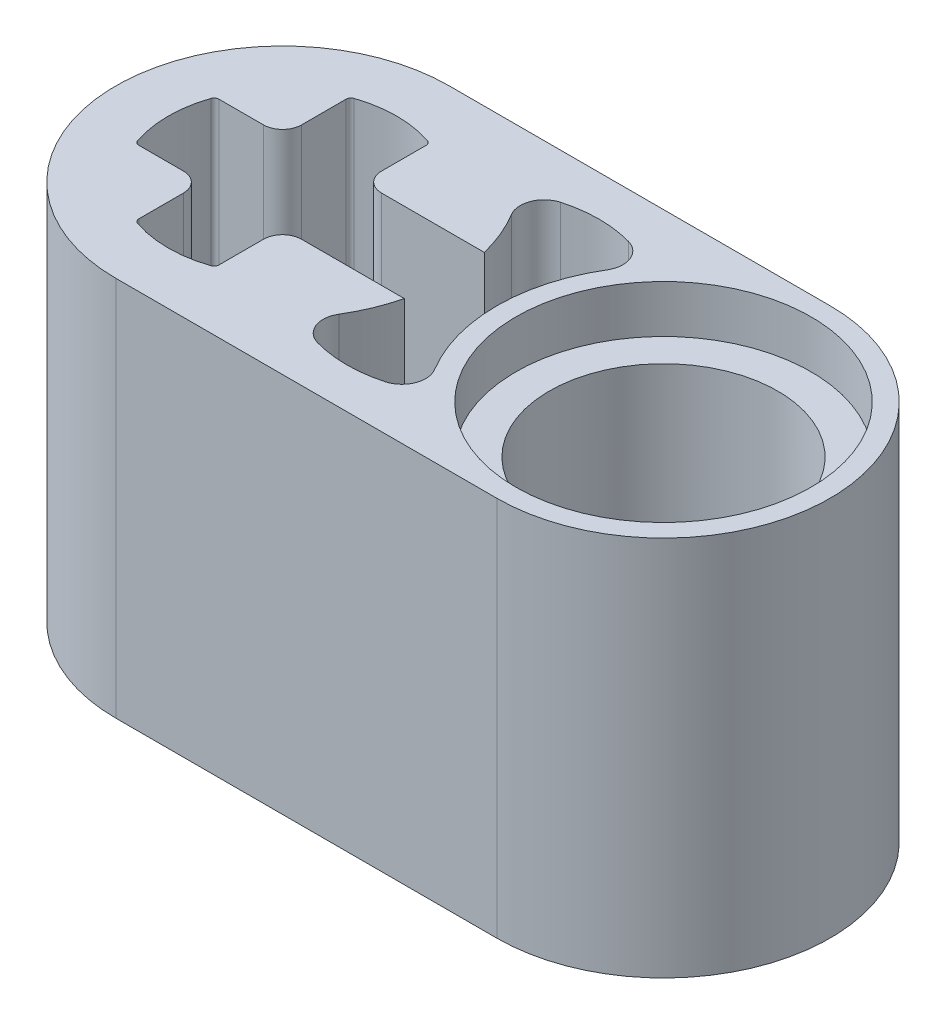
from build123d import *

# Parameters (mm, degrees)
BOSS_EXTRUDE1_DEPTH = 4
SKETCH2_R           = 2.4
CUT_EXTRUDE1_DEPTH  = 12.510864433
SKETCH3_R           = 3.1
CUT_EXTRUDE2_DEPTH  = 1


with BuildPart() as part:
    # Sketch1 → Boss-Extrude1 (new, symmetric)
    with BuildSketch(Plane(origin=(0, 0, 0), x_dir=(1, 0, 0), z_dir=(0, 1, 0))):
        with BuildLine():
            Line((-4, 3.5), (4, 3.5))
            ThreePointArc((4, 3.5), (7.5, 0), (4, -3.5))
            Line((4, -3.5), (-4, -3.5))
            ThreePointArc((-4, -3.5), (-7.5, 0), (-4, 3.5))
        make_face()
    extrude(amount=BOSS_EXTRUDE1_DEPTH, both=True)

    # Sketch2 → Cut-Extrude1 (cut, through all)
    with BuildSketch(Plane(origin=(0, 4, 0), x_dir=(1, 0, 0), z_dir=(0, 1, 0))):
        with Locations(Location((4, 0, 0), (0, 0, 270))):
            Circle(SKETCH2_R)
        with BuildLine():
            Line((-4.84, -2.177705214), (-4.84, -1.24))
            ThreePointArc((-4.84, -1.24), (-4.957157288, -0.957157288), (-5.24, -0.84))
            Line((-5.24, -0.84), (-6.177705214, -0.84))
            ThreePointArc((-6.177705214, -0.84), (-6.235940121, -0.821293884), (-6.27238805, -0.772173913))
            ThreePointArc((-6.27238805, -0.772173913), (-6.4, 0), (-6.27238805, 0.772173913))
            ThreePointArc((-6.27238805, 0.772173913), (-6.235940121, 0.821293884), (-6.177705214, 0.84))
            Line((-6.177705214, 0.84), (-5.24, 0.84))
            ThreePointArc((-5.24, 0.84), (-4.957157288, 0.957157288), (-4.84, 1.24))
            Line((-4.84, 1.24), (-4.84, 2.177705214))
            ThreePointArc((-4.84, 2.177705214), (-4.821293884, 2.235940121), (-4.772173913, 2.27238805))
            ThreePointArc((-4.772173913, 2.27238805), (-4, 2.4), (-3.227826087, 2.27238805))
            ThreePointArc((-3.227826087, 2.27238805), (-3.178706116, 2.235940121), (-3.16, 2.177705214))
            Line((-3.16, 2.177705214), (-3.16, 1.24))
            ThreePointArc((-3.16, 1.24), (-3.042842712, 0.957157288), (-2.76, 0.84))
            Line((-2.76, 0.84), (-1.822294786, 0.84))
            Line((-1.822294786, 0.84), (-0.602294892, 0.84))
            ThreePointArc((-0.602294892, 0.84), (-0.767197546, 1.341263694), (-1.005585937, 1.812038747))
            ThreePointArc((-1.005585937, 1.812038747), (-1.042652048, 2.255086643), (-0.7121875, 2.552506408))
            ThreePointArc((-0.7121875, 2.552506408), (0, 2.65), (0.7121875, 2.552506408))
            ThreePointArc((0.7121875, 2.552506408), (1.042652048, 2.255086643), (1.005585937, 1.812038747))
            ThreePointArc((1.005585937, 1.812038747), (0.5, 0), (1.005585938, -1.812038747))
            ThreePointArc((1.005585938, -1.812038747), (1.042652048, -2.255086643), (0.7121875, -2.552506408))
            ThreePointArc((0.7121875, -2.552506408), (0, -2.65), (-0.7121875, -2.552506408))
            ThreePointArc((-0.7121875, -2.552506408), (-1.042652048, -2.255086643), (-1.005585937, -1.812038747))
            ThreePointArc((-1.005585937, -1.812038747), (-0.767197546, -1.341263694), (-0.602294892, -0.84))
            Line((-0.602294892, -0.84), (-1.822294786, -0.84))
            Line((-1.822294786, -0.84), (-2.76, -0.84))
            ThreePointArc((-2.76, -0.84), (-3.042842712, -0.957157288), (-3.16, -1.24))
            Line((-3.16, -1.24), (-3.16, -2.177705214))
            ThreePointArc((-3.16, -2.177705214), (-3.178706116, -2.235940121), (-3.227826087, -2.27238805))
            ThreePointArc((-3.227826087, -2.27238805), (-4, -2.4), (-4.772173913, -2.27238805))
            ThreePointArc((-4.772173913, -2.27238805), (-4.821293884, -2.235940121), (-4.84, -2.177705214))
        make_face()
    extrude(amount=-CUT_EXTRUDE1_DEPTH, mode=Mode.SUBTRACT)

    # Sketch3 → Cut-Extrude2 (cut)
    with BuildSketch(Plane(origin=(0, 4, 0), x_dir=(1, 0, 0), z_dir=(0, 1, 0))):
        with Locations(Location((4, 0, 0), (0, 0, 270))):
            Circle(SKETCH3_R)
    cut_extrude2 = extrude(amount=-CUT_EXTRUDE2_DEPTH, mode=Mode.SUBTRACT)

    # Mirror1: Cut-Extrude2 across plane
    add(cut_extrude2.mirror(Plane.ZX), mode=Mode.SUBTRACT)


solid = part.part
